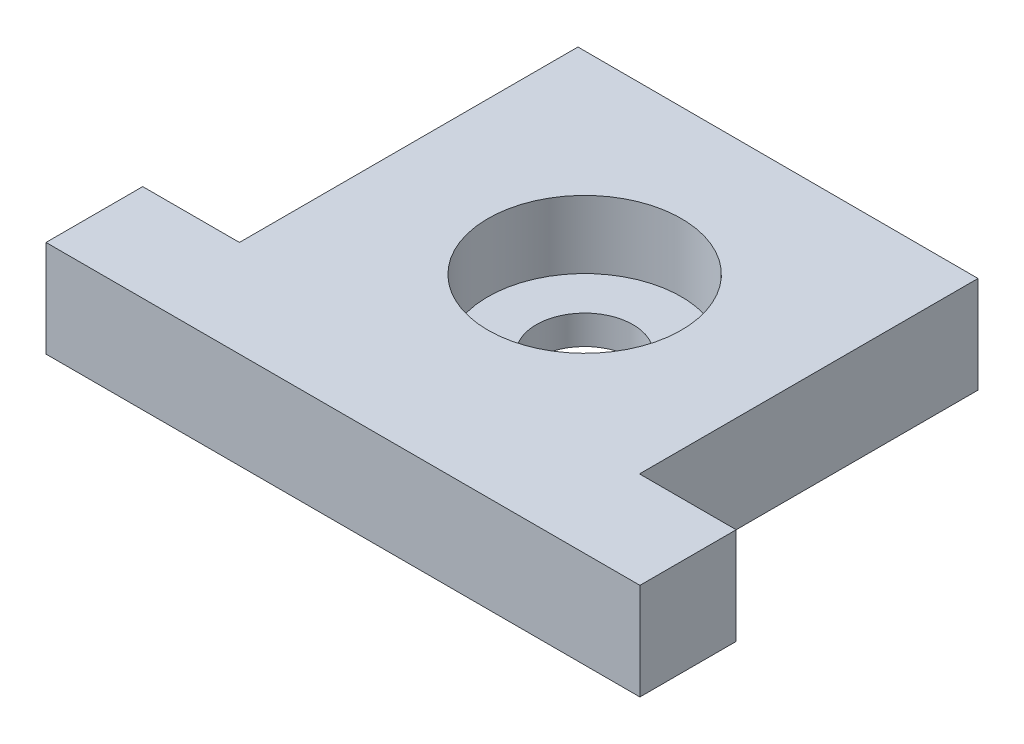
from build123d import *

# Parameters (mm, degrees)
BOSS_EXTRUDE1_DEPTH = 10
SKETCH2_R           = 10
CUT_EXTRUDE2_DEPTH  = 7
SKETCH5_R           = 5
CUT_EXTRUDE3_DEPTH  = 55.924843053


with BuildPart() as part:
    # Sketch1 → Boss-Extrude1 (new body)
    with BuildSketch(Plane(origin=(0, 0, 0), x_dir=(1, 0, 0), z_dir=(0, 1, 0))):
        Polygon((-20.704045081, 45), (20.704045081, 44.955003455), (20.704045081, 9.955003455), (30.704045081, 9.955003455), (30.704045081, 0), (-30.704045081, 0), (-30.704045081, 10), (-20.704045081, 10), align=None)
    extrude(amount=BOSS_EXTRUDE1_DEPTH)

    # Sketch2 → Cut-Extrude2 (cut)
    with BuildSketch(Plane(origin=(0, 10, 0), x_dir=(1, 0, 0), z_dir=(0, 1, 0))):
        with Locations(Location((0, 24.98875086, 0), (0, 0, 270))):
            Circle(SKETCH2_R)
    extrude(amount=-CUT_EXTRUDE2_DEPTH, mode=Mode.SUBTRACT)

    # Sketch5 → Cut-Extrude3 (cut, through all)
    with BuildSketch(Plane(origin=(0, 3, 0), x_dir=(1, 0, 0), z_dir=(0, 1, 0))):
        with Locations(Location((0, 24.98875086, 0), (0, 0, 270))):
            Circle(SKETCH5_R)
    extrude(amount=-CUT_EXTRUDE3_DEPTH, mode=Mode.SUBTRACT)


solid = part.part
